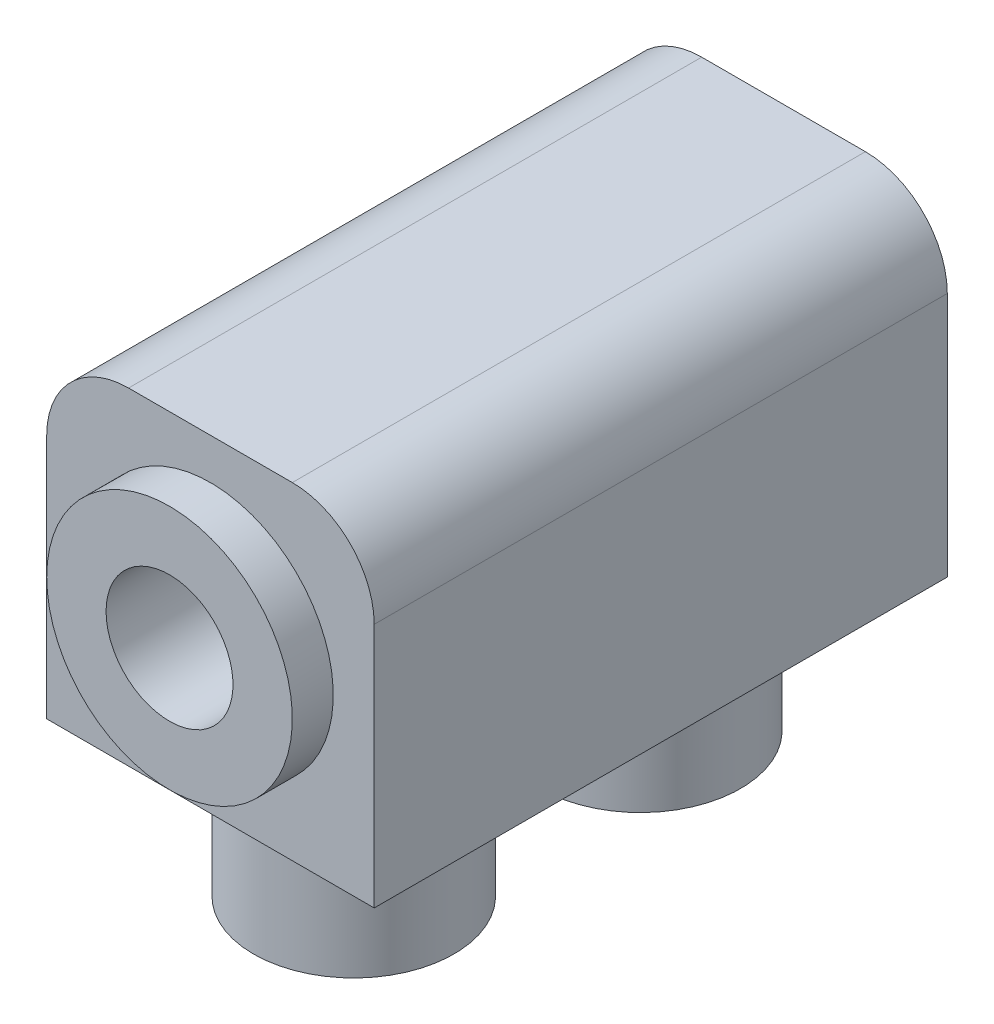
from build123d import *

# Parameters (mm, degrees)
SKETCH1_W           = 8
SKETCH1_H           = 14
BOSS_EXTRUDE1_DEPTH = 8
SKETCH2_R           = 2.45
BOSS_EXTRUDE2_DEPTH = 3.5
FILLET1_R           = 2
SKETCH5_R           = 3
BOSS_EXTRUDE3_DEPTH = 1
SKETCH6_R           = 1.55
CUT_EXTRUDE1_DEPTH  = 20.595917942


with BuildPart() as part:
    # Sketch1 → Boss-Extrude1 (new body)
    with BuildSketch(Plane(origin=(0, 0, 0), x_dir=(1, 0, 0), z_dir=(0, 1, 0))):
        with Locations((4, 7)):
            Rectangle(SKETCH1_W, SKETCH1_H)
    extrude(amount=BOSS_EXTRUDE1_DEPTH)

    # Sketch2 → Boss-Extrude2 (add)
    with BuildSketch(Plane.XZ):
        with Locations(Location((4, -10.5, 0), (0, 0, 270))):
            Circle(SKETCH2_R)
        with Locations(Location((4, -3.5, 0), (0, 0, 90))):
            Circle(SKETCH2_R)
    extrude(amount=BOSS_EXTRUDE2_DEPTH)

    # Fillet1
    fillet1_edges = [part.edges().sort_by_distance(p)[0] for p in [
        (8, 8, -7),
        (0, 8, -7),
    ]]
    fillet(fillet1_edges, radius=FILLET1_R)

    # Sketch5 → Boss-Extrude3 (add)
    with BuildSketch(Plane(origin=(0, 0, -14), x_dir=(-1, 0, 0), z_dir=(0, 0, -1))):
        with Locations((-4, 4)):
            Circle(SKETCH5_R)
    boss_extrude3 = extrude(amount=BOSS_EXTRUDE3_DEPTH)

    # Mirror1: Boss-Extrude3 across plane
    add(boss_extrude3.mirror(Plane(origin=(0, 0, -7), x_dir=(1, 0, 0), z_dir=(0, 0, -1))))

    # Sketch6 → Cut-Extrude1 (cut, through all)
    with BuildSketch(Plane(origin=(0, 0, -15), x_dir=(-1, 0, 0), z_dir=(0, 0, -1))):
        with Locations((-4, 4)):
            Circle(SKETCH6_R)
    extrude(amount=-CUT_EXTRUDE1_DEPTH, mode=Mode.SUBTRACT)


solid = part.part
